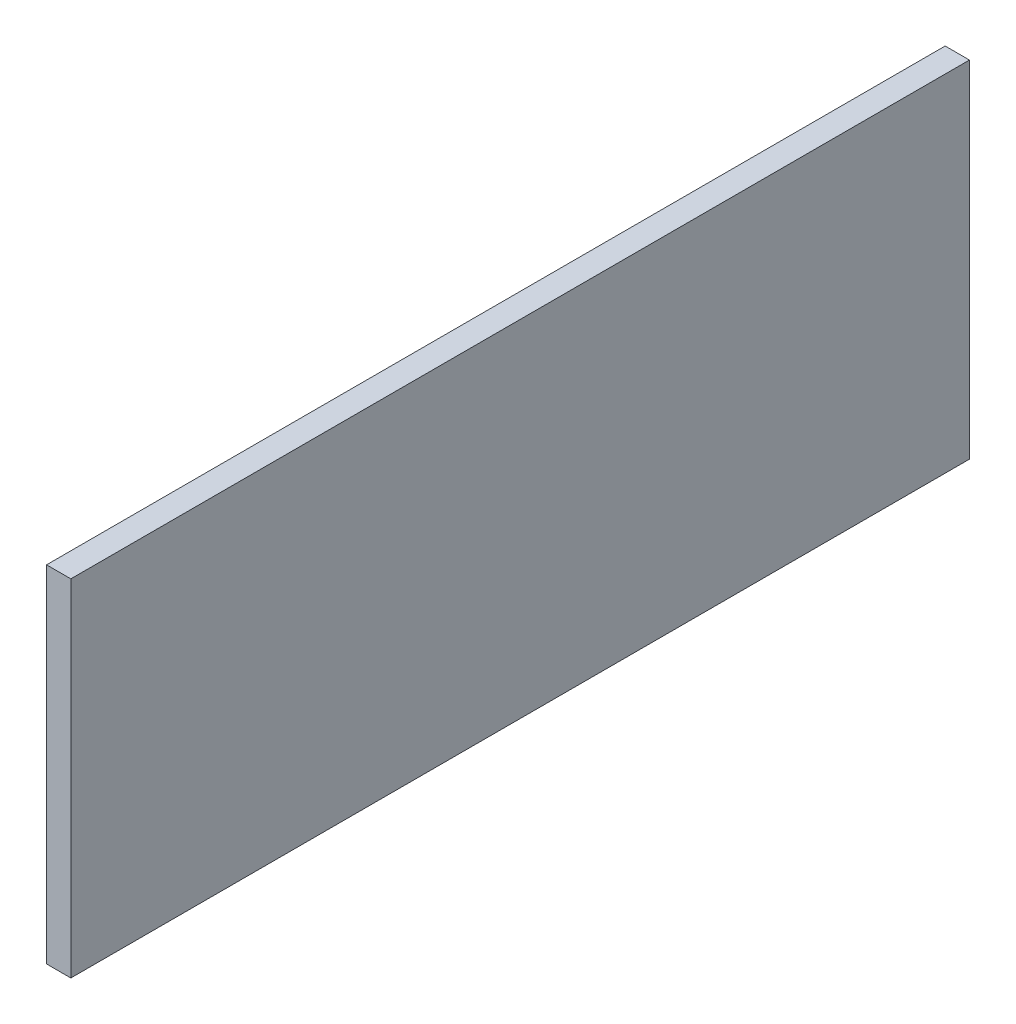
from build123d import *

# Parameters (mm, degrees)
SKETCH1_W           = 222
SKETCH1_H           = 85.4
BOSS_EXTRUDE1_DEPTH = 6


with BuildPart() as part:
    # Sketch1 → Boss-Extrude1 (new body)
    with BuildSketch(Plane(origin=(0, 0, 0), x_dir=(0, 0, -1), z_dir=(1, 0, 0))):
        with Locations((111, 42.7)):
            Rectangle(SKETCH1_W, SKETCH1_H)
    extrude(amount=BOSS_EXTRUDE1_DEPTH)


solid = part.part
